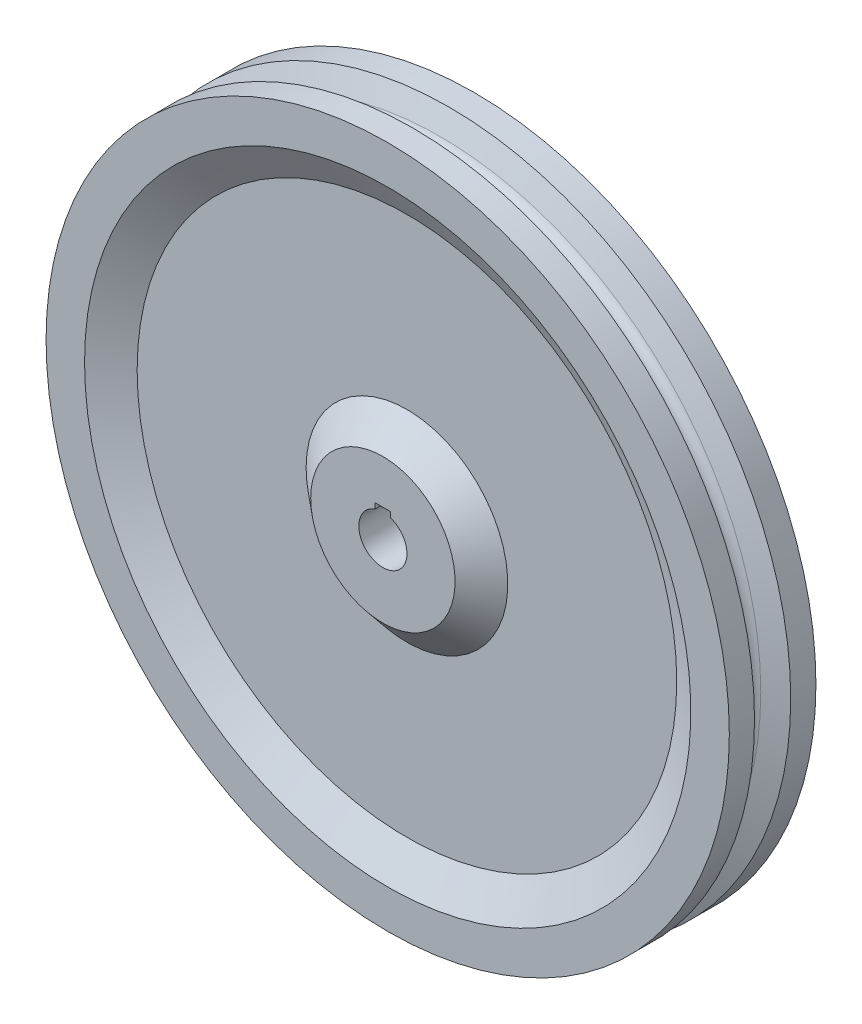
from build123d import *
from build123d.topology import SkipClean

# Parameters (mm, degrees)
ESQUISSE2_R             = 25
ENL_V_MAT_EXTRU_1_DEPTH = 512.908194894
ESQUISSE3_W             = 16
ESQUISSE3_H             = 8.6
ENL_V_MAT_EXTRU_2_DEPTH = 512.908194894
ECHELLE1_SCALE          = 0.5


with BuildPart() as part:
    # Esquisse1 → Révolution1 (revolve)
    with BuildSketch(Plane(origin=(0, 0, 0), x_dir=(0, 0, -1), z_dir=(1, 0, 0)), mode=Mode.PRIVATE) as r_volution1_sk:
        with BuildLine():
            Line((0, 0), (-50, 0))
            Line((-50, 0), (-50, 75))
            Line((-50, 75), (-25, 104.793839815))
            Line((-25, 104.793839815), (-25, 280.358983849))
            Line((-25, 280.358983849), (-45, 315))
            Line((-45, 315), (-45, 355))
            Line((-45, 355), (-18.820962226, 355))
            Line((-18.820962226, 355), (-9.700735091, 332.98182396))
            ThreePointArc((-9.700735091, 332.98182396), (-5.833487447, 328.269569071), (0, 326.5))
            Line((0, 326.5), (0, 0))
        make_face()
    r_volution1 = revolve(r_volution1_sk.sketch.rotate(Axis((0, 0, 0), (0, 0, 1)), 90), axis=Axis((0, 0, 0), (0, 0, 1)))

    # Symétrie1: Révolution1 across plane
    with SkipClean():  # the faces are left unmerged after this step: merging them gives an invalid solid
        add(r_volution1.mirror(Plane(origin=(0, 326.5, 0), x_dir=(1, 0, 0), z_dir=(0, 0, -1))))

    # Esquisse2 → Enlèv. mat.-Extru.1 (cut, through all)
    with SkipClean():  # the faces are left unmerged after this step: merging them gives an invalid solid
        with BuildSketch(Plane.XY.offset(50)):
            Circle(ESQUISSE2_R)
        extrude(amount=-ENL_V_MAT_EXTRU_1_DEPTH, mode=Mode.SUBTRACT)

    # Esquisse3 → Enlèv. mat.-Extru.2 (cut, through all)
    with SkipClean():  # the faces are left unmerged after this step: merging them gives an invalid solid
        with BuildSketch(Plane.XY.offset(50)):
            with Locations((0, 25)):
                Rectangle(ESQUISSE3_W, ESQUISSE3_H)
        extrude(amount=-ENL_V_MAT_EXTRU_2_DEPTH, mode=Mode.SUBTRACT)


with BuildPart() as part_1:
    # Echelle1: scaled about (0, -0.00849014, 0)
    add(part.part.scale(ECHELLE1_SCALE).moved(Location((0, -0.00424507, 0))))


solid = part_1.part
